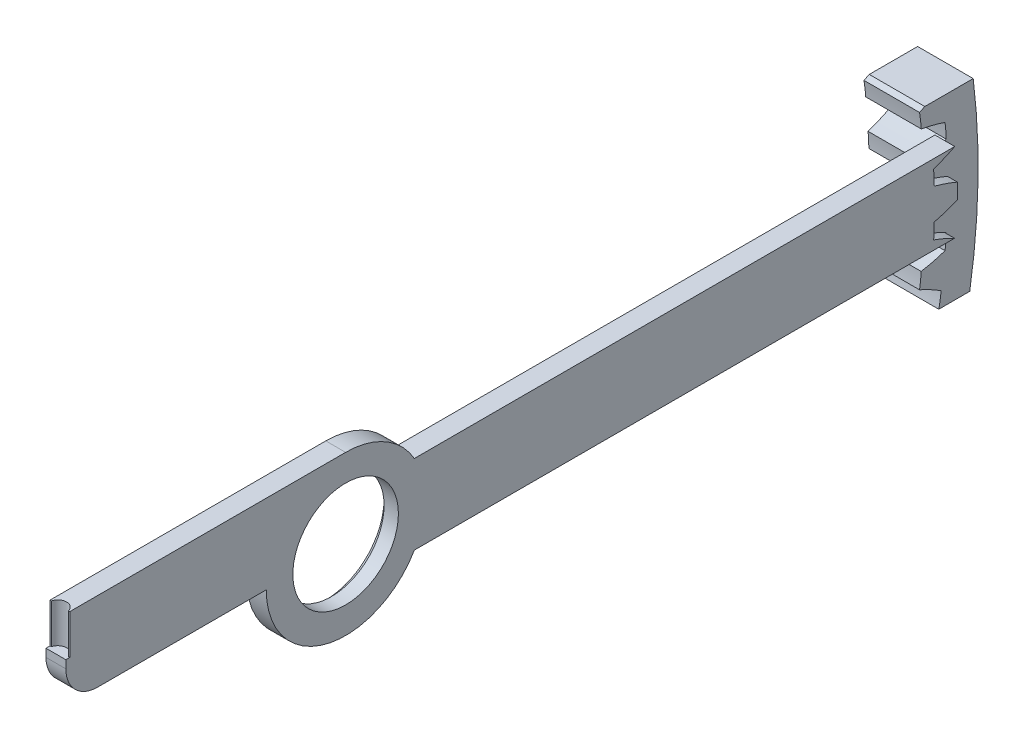
from build123d import *

# Parameters (mm, degrees)
SKETCH_1_R          = 6.65
EXTRUDE_1_DEPTH     = 1.25
EXTRUDE_2_DEPTH     = 7
SKETCH_3_R          = 1.1
CUT_EXTRUDE_1_DEPTH = 5
CHAMFER_1_SIZE      = 0.7


with BuildPart() as part:
    # Эскиз1 → Бобышка-Вытянуть1 (new, symmetric)
    with BuildSketch(Plane(origin=(0, 0, 0), x_dir=(0, 0, -1), z_dir=(1, 0, 0))):
        with BuildLine():
            Line((-31.25, 0), (-10, 0))
            ThreePointArc((-10, 0), (-2.588190451, -9.659258263), (8.660254038, -5))
            Line((8.660254038, -5), (76.721847542, -5))
            ThreePointArc((76.721847542, -5), (75.425886146, -4.389181279), (74.09117429, -3.868451302))
            ThreePointArc((74.09117429, -3.868451302), (74.147561595, -2.912548148), (74.149130868, -1.954984622))
            ThreePointArc((74.149130868, -1.954984622), (75.638846987, -1.51744657), (77.087831178, -0.959648686))
            ThreePointArc((77.087831178, -0.959648686), (77.109856091, -0.006099484), (77.083941958, 0.947351948))
            ThreePointArc((77.083941958, 0.947351948), (75.643750299, 1.505844774), (74.166291118, 1.956600379))
            ThreePointArc((74.166291118, 1.956600379), (74.147505302, 2.913980899), (74.073940169, 3.8687157))
            ThreePointArc((74.073940169, 3.8687157), (75.433826566, 4.383081961), (76.750365892, 5))
            Line((76.750365892, 5), (8.660254038, 5))
            ThreePointArc((8.660254038, 5), (5, 8.660254038), (0, 10))
            Line((0, 10), (-34.75, 10))
            Line((-34.75, 10), (-34.75, 5))
            Line((-34.75, 5), (-35.25, 5))
            Line((-35.25, 5), (-35.25, 4))
            ThreePointArc((-35.25, 4), (-34.078427125, 1.171572875), (-31.25, 0))
        make_face()
        Circle(SKETCH_1_R, mode=Mode.SUBTRACT)
    extrude(amount=EXTRUDE_1_DEPTH, both=True)

    # Эскиз1<5> → Бобышка-Вытянуть2 (add)
    with BuildSketch(Plane(origin=(0, 0, 0), x_dir=(0, 0, -1), z_dir=(1, 0, 0))):
        with BuildLine():
            Line((73.559260736, 9.685830974), (74.227172899, 10))
            Line((74.227172899, 10), (80.32185029, 10))
            ThreePointArc((80.32185029, 10), (80.927765714, -1.515378033), (79.891173693, -13))
            Line((79.891173693, -13), (75.988629927, -13.007027449))
            ThreePointArc((75.988629927, -13.007027449), (76.159551637, -12.068663477), (76.283109214, -11.12289675))
            ThreePointArc((76.283109214, -11.12289675), (74.948016231, -10.345984286), (73.559260736, -9.669652694))
            ThreePointArc((73.559260736, -9.669652694), (73.690473514, -8.721120367), (73.767167518, -7.766631814))
            ThreePointArc((73.767167518, -7.766631814), (75.28662018, -7.447324325), (76.774901953, -7.004931935))
            ThreePointArc((76.774901953, -7.004931935), (76.871673579, -6.056050262), (76.920646267, -5.103504803))
            ThreePointArc((76.920646267, -5.103504803), (75.528713081, -4.433737489), (74.09117429, -3.868451302))
            ThreePointArc((74.09117429, -3.868451302), (74.147561595, -2.912548148), (74.149130868, -1.954984622))
            ThreePointArc((74.149130868, -1.954984622), (75.638846987, -1.51744657), (77.087831178, -0.959648686))
            ThreePointArc((77.087831178, -0.959648686), (77.109856091, -0.006099484), (77.083941958, 0.947351948))
            ThreePointArc((77.083941958, 0.947351948), (75.643750299, 1.505844774), (74.166291118, 1.956600379))
            ThreePointArc((74.166291118, 1.956600379), (74.147505302, 2.913980899), (74.073940169, 3.8687157))
            ThreePointArc((74.073940169, 3.8687157), (75.524735151, 4.421786748), (76.925488289, 5.091551117))
            ThreePointArc((76.925488289, 5.091551117), (76.872630699, 6.043888899), (76.771989513, 6.992367959))
            ThreePointArc((76.771989513, 6.992367959), (75.292418643, 7.436143003), (73.784148097, 7.769588967))
            ThreePointArc((73.784148097, 7.769588967), (73.691130431, 8.729989779), (73.559260736, 9.685830974))
        make_face()
    extrude(amount=-EXTRUDE_2_DEPTH)

    # Эскиз3 → Вырез-Вытянуть1 (cut)
    with BuildSketch(Plane(origin=(0, 10, 0), x_dir=(1, 0, 0), z_dir=(0, 1, 0))):
        with Locations((0, -35)):
            Circle(SKETCH_3_R)
    extrude(amount=-CUT_EXTRUDE_1_DEPTH, mode=Mode.SUBTRACT)

    # Фаска1
    chamfer_1_edges = [part.edges().sort_by_distance(p)[0] for p in [
        (-1.25, 0, 6.65),
    ]]
    chamfer(chamfer_1_edges, length=CHAMFER_1_SIZE)


solid = part.part
